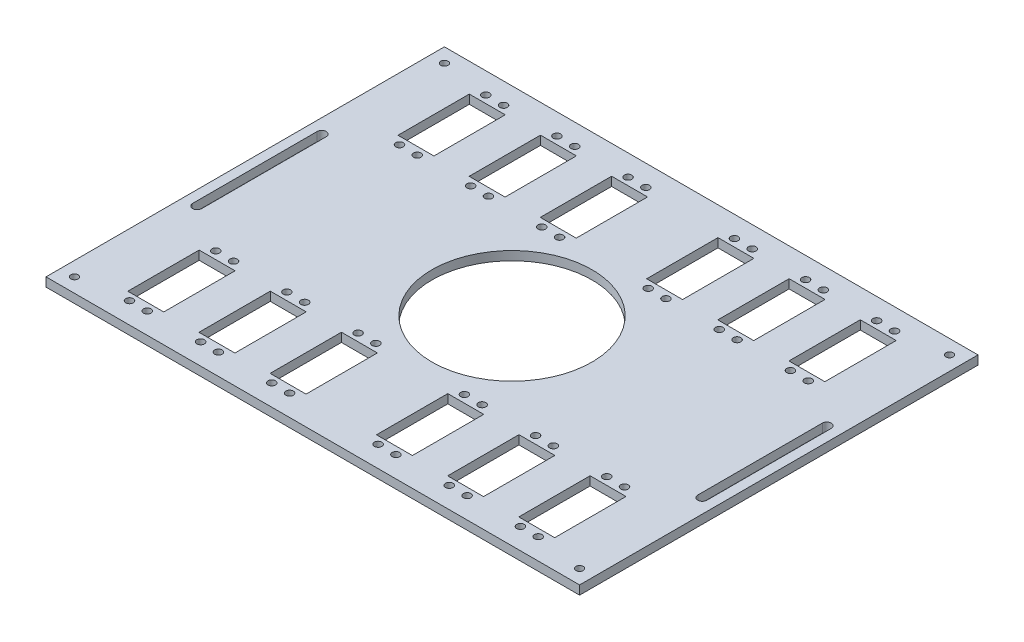
from build123d import *

# Parameters (mm, degrees)
SKETCH1_W                                  = 300
SKETCH1_H                                  = 224
BOSS_EXTRUDE2_DEPTH                        = 5
CUT_EXTRUDE1_REACH                         = 189.267
SKETCH1_5_W                                = 20.2
SKETCH1_5_H                                = 40.1
SKETCH1_5_R                                = 2.1
LPATTERN1_COUNT                            = 3
LPATTERN1_PITCH                            = 40
MIRROR1_COPY_1_REACH                       = 189.267
MIRROR1_COPY_1_SKETCH_W                    = 20.2
MIRROR1_COPY_1_SKETCH_H                    = 40.1
MIRROR1_COPY_1_SKETCH_R                    = 2.1
MIRROR1_COPY_2_REACH                       = 189.267
MIRROR1_COPY_2_SKETCH_W                    = 20.2
MIRROR1_COPY_2_SKETCH_H                    = 40.1
MIRROR1_COPY_2_SKETCH_R                    = 2.1
MIRROR1_AT_THE_SECOND_PLANE_COPY_1_REACH   = 189.267
MIRROR1_AT_THE_SECOND_PLANE_COPY_1_SKETC_W = 20.2
MIRROR1_AT_THE_SECOND_PLANE_COPY_1_SKETC_H = 40.1
MIRROR1_AT_THE_SECOND_PLANE_COPY_1_SKETC_R = 2.1
MIRROR1_AT_THE_SECOND_PLANE_COPY_2_REACH   = 189.267
MIRROR1_AT_THE_SECOND_PLANE_COPY_2_SKETC_W = 20.2
MIRROR1_AT_THE_SECOND_PLANE_COPY_2_SKETC_H = 40.1
MIRROR1_AT_THE_SECOND_PLANE_COPY_2_SKETC_R = 2.1
MIRROR1_AT_THE_SECOND_PLANE_COPY_3_REACH   = 189.267
MIRROR1_AT_THE_SECOND_PLANE_COPY_3_SKETC_W = 20.2
MIRROR1_AT_THE_SECOND_PLANE_COPY_3_SKETC_H = 40.1
MIRROR1_AT_THE_SECOND_PLANE_COPY_3_SKETC_R = 2.1
MIRROR1_AT_THE_SECOND_PLANE_COPY_4_REACH   = 189.267
MIRROR1_AT_THE_SECOND_PLANE_COPY_4_SKETC_W = 20.2
MIRROR1_AT_THE_SECOND_PLANE_COPY_4_SKETC_H = 40.1
MIRROR1_AT_THE_SECOND_PLANE_COPY_4_SKETC_R = 2.1
MIRROR1_AT_THE_SECOND_PLANE_COPY_5_REACH   = 189.267
MIRROR1_AT_THE_SECOND_PLANE_COPY_5_SKETC_W = 20.2
MIRROR1_AT_THE_SECOND_PLANE_COPY_5_SKETC_H = 40.1
MIRROR1_AT_THE_SECOND_PLANE_COPY_5_SKETC_R = 2.1
CUT_EXTRUDE3_REACH                         = 189.267
SKETCH1_6_R                                = 2.05
MIRROR2_AT_THE_SECOND_PLANE_COPY_1_REACH   = 189.267
MIRROR2_AT_THE_SECOND_PLANE_COPY_1_SKETC_R = 2.05
CUT_EXTRUDE4_REACH                         = 189.267
SKETCH2_R                                  = 45
CUT_EXTRUDE5_DEPTH                         = 10


with BuildPart() as part:
    # Sketch1 → Boss-Extrude2 (new body)
    with BuildSketch(Plane(origin=(0, 0, 0), x_dir=(1, 0, 0), z_dir=(0, 1, 0))):
        Rectangle(SKETCH1_W, SKETCH1_H)
    extrude(amount=BOSS_EXTRUDE2_DEPTH)

    # Sketch1<5> → Cut-Extrude1 (cut, up to next)
    with BuildSketch(Plane(origin=(0, 0, 0), x_dir=(1, 0, 0), z_dir=(0, 1, 0)), mode=Mode.PRIVATE) as cut_extrude1_sk1:
        with Locations((-109.9, 75.95)):
            Rectangle(SKETCH1_5_W, SKETCH1_5_H)
    cut_extrude1_tool1 = extrude(cut_extrude1_sk1.sketch, amount=CUT_EXTRUDE1_REACH, mode=Mode.PRIVATE) & part.part
    # Sketch1<5> → Cut-Extrude1 (cut, up to next)
    with BuildSketch(Plane(origin=(0, 0, 0), x_dir=(1, 0, 0), z_dir=(0, 1, 0)), mode=Mode.PRIVATE) as cut_extrude1_sk2:
        with Locations(Location((-104.9, 100.155703663, 0), (0, 0, 270))):
            Circle(SKETCH1_5_R)
    cut_extrude1_tool2 = extrude(cut_extrude1_sk2.sketch, amount=CUT_EXTRUDE1_REACH, mode=Mode.PRIVATE) & part.part
    # Sketch1<5> → Cut-Extrude1 (cut, up to next)
    with BuildSketch(Plane(origin=(0, 0, 0), x_dir=(1, 0, 0), z_dir=(0, 1, 0)), mode=Mode.PRIVATE) as cut_extrude1_sk3:
        with Locations(Location((-114.9, 100.155703663, 0), (0, 0, 270))):
            Circle(SKETCH1_5_R)
    cut_extrude1_tool3 = extrude(cut_extrude1_sk3.sketch, amount=CUT_EXTRUDE1_REACH, mode=Mode.PRIVATE) & part.part
    # Sketch1<5> → Cut-Extrude1 (cut, up to next)
    with BuildSketch(Plane(origin=(0, 0, 0), x_dir=(1, 0, 0), z_dir=(0, 1, 0)), mode=Mode.PRIVATE) as cut_extrude1_sk4:
        with Locations(Location((-114.9, 51.655703663, 0), (0, 0, 270))):
            Circle(SKETCH1_5_R)
    cut_extrude1_tool4 = extrude(cut_extrude1_sk4.sketch, amount=CUT_EXTRUDE1_REACH, mode=Mode.PRIVATE) & part.part
    # Sketch1<5> → Cut-Extrude1 (cut, up to next)
    with BuildSketch(Plane(origin=(0, 0, 0), x_dir=(1, 0, 0), z_dir=(0, 1, 0)), mode=Mode.PRIVATE) as cut_extrude1_sk5:
        with Locations(Location((-104.9, 51.655703663, 0), (0, 0, 270))):
            Circle(SKETCH1_5_R)
    cut_extrude1_tool5 = extrude(cut_extrude1_sk5.sketch, amount=CUT_EXTRUDE1_REACH, mode=Mode.PRIVATE) & part.part
    cut_extrude1_1 = cut_extrude1_tool1.solids().sort_by_distance((-109.9, 0, -75.95))[0]
    add(cut_extrude1_1, mode=Mode.SUBTRACT)
    cut_extrude1_2 = cut_extrude1_tool2.solids().sort_by_distance((-104.9, 0, -100.155704))[0]
    add(cut_extrude1_2, mode=Mode.SUBTRACT)
    cut_extrude1_3 = cut_extrude1_tool3.solids().sort_by_distance((-114.9, 0, -100.155704))[0]
    add(cut_extrude1_3, mode=Mode.SUBTRACT)
    cut_extrude1_4 = cut_extrude1_tool4.solids().sort_by_distance((-114.9, 0, -51.655704))[0]
    add(cut_extrude1_4, mode=Mode.SUBTRACT)
    cut_extrude1_5 = cut_extrude1_tool5.solids().sort_by_distance((-104.9, 0, -51.655704))[0]
    add(cut_extrude1_5, mode=Mode.SUBTRACT)
    cut_extrude1 = cut_extrude1_1 + cut_extrude1_2 + cut_extrude1_3 + cut_extrude1_4 + cut_extrude1_5  # Cut-Extrude1 as one shape, for the pattern or mirror that repeats it

    # LPattern1: Cut-Extrude1 ×3
    with Locations(*[(i * LPATTERN1_PITCH, 0, 0) for i in range(1, LPATTERN1_COUNT)]):
        add(cut_extrude1, mode=Mode.SUBTRACT)

    # Mirror1: Cut-Extrude1 across plane
    add(cut_extrude1.mirror(Plane.XY), mode=Mode.SUBTRACT)

    # Mirror1 copy 1 sketch → Mirror1 copy 1 (cut, up to next)
    with BuildSketch(Plane(origin=(40, 0, 0), x_dir=(1, 0, 0), z_dir=(0, 1, 0)), mode=Mode.PRIVATE) as mirror1_copy_1_sk1:
        with Locations((-109.9, -75.95)):
            Rectangle(MIRROR1_COPY_1_SKETCH_W, MIRROR1_COPY_1_SKETCH_H)
    mirror1_copy_1_tool1 = extrude(mirror1_copy_1_sk1.sketch, amount=MIRROR1_COPY_1_REACH, mode=Mode.PRIVATE) & part.part
    # Mirror1 copy 1 sketch → Mirror1 copy 1 (cut, up to next)
    with BuildSketch(Plane(origin=(40, 0, 0), x_dir=(1, 0, 0), z_dir=(0, 1, 0)), mode=Mode.PRIVATE) as mirror1_copy_1_sk2:
        with Locations((-104.9, -100.155703663)):
            Circle(MIRROR1_COPY_1_SKETCH_R)
    mirror1_copy_1_tool2 = extrude(mirror1_copy_1_sk2.sketch, amount=MIRROR1_COPY_1_REACH, mode=Mode.PRIVATE) & part.part
    # Mirror1 copy 1 sketch → Mirror1 copy 1 (cut, up to next)
    with BuildSketch(Plane(origin=(40, 0, 0), x_dir=(1, 0, 0), z_dir=(0, 1, 0)), mode=Mode.PRIVATE) as mirror1_copy_1_sk3:
        with Locations((-114.9, -100.155703663)):
            Circle(MIRROR1_COPY_1_SKETCH_R)
    mirror1_copy_1_tool3 = extrude(mirror1_copy_1_sk3.sketch, amount=MIRROR1_COPY_1_REACH, mode=Mode.PRIVATE) & part.part
    # Mirror1 copy 1 sketch → Mirror1 copy 1 (cut, up to next)
    with BuildSketch(Plane(origin=(40, 0, 0), x_dir=(1, 0, 0), z_dir=(0, 1, 0)), mode=Mode.PRIVATE) as mirror1_copy_1_sk4:
        with Locations((-114.9, -51.655703663)):
            Circle(MIRROR1_COPY_1_SKETCH_R)
    mirror1_copy_1_tool4 = extrude(mirror1_copy_1_sk4.sketch, amount=MIRROR1_COPY_1_REACH, mode=Mode.PRIVATE) & part.part
    # Mirror1 copy 1 sketch → Mirror1 copy 1 (cut, up to next)
    with BuildSketch(Plane(origin=(40, 0, 0), x_dir=(1, 0, 0), z_dir=(0, 1, 0)), mode=Mode.PRIVATE) as mirror1_copy_1_sk5:
        with Locations((-104.9, -51.655703663)):
            Circle(MIRROR1_COPY_1_SKETCH_R)
    mirror1_copy_1_tool5 = extrude(mirror1_copy_1_sk5.sketch, amount=MIRROR1_COPY_1_REACH, mode=Mode.PRIVATE) & part.part
    add(mirror1_copy_1_tool1.solids().sort_by_distance((-69.9, 0, 75.95))[0], mode=Mode.SUBTRACT)
    add(mirror1_copy_1_tool2.solids().sort_by_distance((-64.9, 0, 100.155704))[0], mode=Mode.SUBTRACT)
    add(mirror1_copy_1_tool3.solids().sort_by_distance((-74.9, 0, 100.155704))[0], mode=Mode.SUBTRACT)
    add(mirror1_copy_1_tool4.solids().sort_by_distance((-74.9, 0, 51.655704))[0], mode=Mode.SUBTRACT)
    add(mirror1_copy_1_tool5.solids().sort_by_distance((-64.9, 0, 51.655704))[0], mode=Mode.SUBTRACT)

    # Mirror1 copy 2 sketch → Mirror1 copy 2 (cut, up to next)
    with BuildSketch(Plane(origin=(80, 0, 0), x_dir=(1, 0, 0), z_dir=(0, 1, 0)), mode=Mode.PRIVATE) as mirror1_copy_2_sk1:
        with Locations((-109.9, -75.95)):
            Rectangle(MIRROR1_COPY_2_SKETCH_W, MIRROR1_COPY_2_SKETCH_H)
    mirror1_copy_2_tool1 = extrude(mirror1_copy_2_sk1.sketch, amount=MIRROR1_COPY_2_REACH, mode=Mode.PRIVATE) & part.part
    # Mirror1 copy 2 sketch → Mirror1 copy 2 (cut, up to next)
    with BuildSketch(Plane(origin=(80, 0, 0), x_dir=(1, 0, 0), z_dir=(0, 1, 0)), mode=Mode.PRIVATE) as mirror1_copy_2_sk2:
        with Locations((-104.9, -100.155703663)):
            Circle(MIRROR1_COPY_2_SKETCH_R)
    mirror1_copy_2_tool2 = extrude(mirror1_copy_2_sk2.sketch, amount=MIRROR1_COPY_2_REACH, mode=Mode.PRIVATE) & part.part
    # Mirror1 copy 2 sketch → Mirror1 copy 2 (cut, up to next)
    with BuildSketch(Plane(origin=(80, 0, 0), x_dir=(1, 0, 0), z_dir=(0, 1, 0)), mode=Mode.PRIVATE) as mirror1_copy_2_sk3:
        with Locations((-114.9, -100.155703663)):
            Circle(MIRROR1_COPY_2_SKETCH_R)
    mirror1_copy_2_tool3 = extrude(mirror1_copy_2_sk3.sketch, amount=MIRROR1_COPY_2_REACH, mode=Mode.PRIVATE) & part.part
    # Mirror1 copy 2 sketch → Mirror1 copy 2 (cut, up to next)
    with BuildSketch(Plane(origin=(80, 0, 0), x_dir=(1, 0, 0), z_dir=(0, 1, 0)), mode=Mode.PRIVATE) as mirror1_copy_2_sk4:
        with Locations((-114.9, -51.655703663)):
            Circle(MIRROR1_COPY_2_SKETCH_R)
    mirror1_copy_2_tool4 = extrude(mirror1_copy_2_sk4.sketch, amount=MIRROR1_COPY_2_REACH, mode=Mode.PRIVATE) & part.part
    # Mirror1 copy 2 sketch → Mirror1 copy 2 (cut, up to next)
    with BuildSketch(Plane(origin=(80, 0, 0), x_dir=(1, 0, 0), z_dir=(0, 1, 0)), mode=Mode.PRIVATE) as mirror1_copy_2_sk5:
        with Locations((-104.9, -51.655703663)):
            Circle(MIRROR1_COPY_2_SKETCH_R)
    mirror1_copy_2_tool5 = extrude(mirror1_copy_2_sk5.sketch, amount=MIRROR1_COPY_2_REACH, mode=Mode.PRIVATE) & part.part
    add(mirror1_copy_2_tool1.solids().sort_by_distance((-29.9, 0, 75.95))[0], mode=Mode.SUBTRACT)
    add(mirror1_copy_2_tool2.solids().sort_by_distance((-24.9, 0, 100.155704))[0], mode=Mode.SUBTRACT)
    add(mirror1_copy_2_tool3.solids().sort_by_distance((-34.9, 0, 100.155704))[0], mode=Mode.SUBTRACT)
    add(mirror1_copy_2_tool4.solids().sort_by_distance((-34.9, 0, 51.655704))[0], mode=Mode.SUBTRACT)
    add(mirror1_copy_2_tool5.solids().sort_by_distance((-24.9, 0, 51.655704))[0], mode=Mode.SUBTRACT)

    # Mirror1 at the second plane: Cut-Extrude1 across plane
    add(cut_extrude1.mirror(Plane(origin=(0, 0, 0), x_dir=(0, 0, 1), z_dir=(1, 0, 0))), mode=Mode.SUBTRACT)

    # Mirror1 at the second plane copy 1 sketc → Mirror1 at the second plane copy 1 (cut, up to next)
    with BuildSketch(Plane(origin=(-40, 0, 0), x_dir=(-1, 0, 0), z_dir=(0, 1, 0)), mode=Mode.PRIVATE) as mirror1_at_the_second_plane_copy_1_sk1:
        with Locations((-109.9, -75.95)):
            Rectangle(MIRROR1_AT_THE_SECOND_PLANE_COPY_1_SKETC_W, MIRROR1_AT_THE_SECOND_PLANE_COPY_1_SKETC_H)
    mirror1_at_the_second_plane_copy_1_tool1 = extrude(mirror1_at_the_second_plane_copy_1_sk1.sketch, amount=MIRROR1_AT_THE_SECOND_PLANE_COPY_1_REACH, mode=Mode.PRIVATE) & part.part
    # Mirror1 at the second plane copy 1 sketc → Mirror1 at the second plane copy 1 (cut, up to next)
    with BuildSketch(Plane(origin=(-40, 0, 0), x_dir=(-1, 0, 0), z_dir=(0, 1, 0)), mode=Mode.PRIVATE) as mirror1_at_the_second_plane_copy_1_sk2:
        with Locations((-104.9, -100.155703663)):
            Circle(MIRROR1_AT_THE_SECOND_PLANE_COPY_1_SKETC_R)
    mirror1_at_the_second_plane_copy_1_tool2 = extrude(mirror1_at_the_second_plane_copy_1_sk2.sketch, amount=MIRROR1_AT_THE_SECOND_PLANE_COPY_1_REACH, mode=Mode.PRIVATE) & part.part
    # Mirror1 at the second plane copy 1 sketc → Mirror1 at the second plane copy 1 (cut, up to next)
    with BuildSketch(Plane(origin=(-40, 0, 0), x_dir=(-1, 0, 0), z_dir=(0, 1, 0)), mode=Mode.PRIVATE) as mirror1_at_the_second_plane_copy_1_sk3:
        with Locations((-114.9, -100.155703663)):
            Circle(MIRROR1_AT_THE_SECOND_PLANE_COPY_1_SKETC_R)
    mirror1_at_the_second_plane_copy_1_tool3 = extrude(mirror1_at_the_second_plane_copy_1_sk3.sketch, amount=MIRROR1_AT_THE_SECOND_PLANE_COPY_1_REACH, mode=Mode.PRIVATE) & part.part
    # Mirror1 at the second plane copy 1 sketc → Mirror1 at the second plane copy 1 (cut, up to next)
    with BuildSketch(Plane(origin=(-40, 0, 0), x_dir=(-1, 0, 0), z_dir=(0, 1, 0)), mode=Mode.PRIVATE) as mirror1_at_the_second_plane_copy_1_sk4:
        with Locations((-114.9, -51.655703663)):
            Circle(MIRROR1_AT_THE_SECOND_PLANE_COPY_1_SKETC_R)
    mirror1_at_the_second_plane_copy_1_tool4 = extrude(mirror1_at_the_second_plane_copy_1_sk4.sketch, amount=MIRROR1_AT_THE_SECOND_PLANE_COPY_1_REACH, mode=Mode.PRIVATE) & part.part
    # Mirror1 at the second plane copy 1 sketc → Mirror1 at the second plane copy 1 (cut, up to next)
    with BuildSketch(Plane(origin=(-40, 0, 0), x_dir=(-1, 0, 0), z_dir=(0, 1, 0)), mode=Mode.PRIVATE) as mirror1_at_the_second_plane_copy_1_sk5:
        with Locations((-104.9, -51.655703663)):
            Circle(MIRROR1_AT_THE_SECOND_PLANE_COPY_1_SKETC_R)
    mirror1_at_the_second_plane_copy_1_tool5 = extrude(mirror1_at_the_second_plane_copy_1_sk5.sketch, amount=MIRROR1_AT_THE_SECOND_PLANE_COPY_1_REACH, mode=Mode.PRIVATE) & part.part
    add(mirror1_at_the_second_plane_copy_1_tool1.solids().sort_by_distance((69.9, 0, -75.95))[0], mode=Mode.SUBTRACT)
    add(mirror1_at_the_second_plane_copy_1_tool2.solids().sort_by_distance((64.9, 0, -100.155704))[0], mode=Mode.SUBTRACT)
    add(mirror1_at_the_second_plane_copy_1_tool3.solids().sort_by_distance((74.9, 0, -100.155704))[0], mode=Mode.SUBTRACT)
    add(mirror1_at_the_second_plane_copy_1_tool4.solids().sort_by_distance((74.9, 0, -51.655704))[0], mode=Mode.SUBTRACT)
    add(mirror1_at_the_second_plane_copy_1_tool5.solids().sort_by_distance((64.9, 0, -51.655704))[0], mode=Mode.SUBTRACT)

    # Mirror1 at the second plane copy 2 sketc → Mirror1 at the second plane copy 2 (cut, up to next)
    with BuildSketch(Plane(origin=(-80, 0, 0), x_dir=(-1, 0, 0), z_dir=(0, 1, 0)), mode=Mode.PRIVATE) as mirror1_at_the_second_plane_copy_2_sk1:
        with Locations((-109.9, -75.95)):
            Rectangle(MIRROR1_AT_THE_SECOND_PLANE_COPY_2_SKETC_W, MIRROR1_AT_THE_SECOND_PLANE_COPY_2_SKETC_H)
    mirror1_at_the_second_plane_copy_2_tool1 = extrude(mirror1_at_the_second_plane_copy_2_sk1.sketch, amount=MIRROR1_AT_THE_SECOND_PLANE_COPY_2_REACH, mode=Mode.PRIVATE) & part.part
    # Mirror1 at the second plane copy 2 sketc → Mirror1 at the second plane copy 2 (cut, up to next)
    with BuildSketch(Plane(origin=(-80, 0, 0), x_dir=(-1, 0, 0), z_dir=(0, 1, 0)), mode=Mode.PRIVATE) as mirror1_at_the_second_plane_copy_2_sk2:
        with Locations((-104.9, -100.155703663)):
            Circle(MIRROR1_AT_THE_SECOND_PLANE_COPY_2_SKETC_R)
    mirror1_at_the_second_plane_copy_2_tool2 = extrude(mirror1_at_the_second_plane_copy_2_sk2.sketch, amount=MIRROR1_AT_THE_SECOND_PLANE_COPY_2_REACH, mode=Mode.PRIVATE) & part.part
    # Mirror1 at the second plane copy 2 sketc → Mirror1 at the second plane copy 2 (cut, up to next)
    with BuildSketch(Plane(origin=(-80, 0, 0), x_dir=(-1, 0, 0), z_dir=(0, 1, 0)), mode=Mode.PRIVATE) as mirror1_at_the_second_plane_copy_2_sk3:
        with Locations((-114.9, -100.155703663)):
            Circle(MIRROR1_AT_THE_SECOND_PLANE_COPY_2_SKETC_R)
    mirror1_at_the_second_plane_copy_2_tool3 = extrude(mirror1_at_the_second_plane_copy_2_sk3.sketch, amount=MIRROR1_AT_THE_SECOND_PLANE_COPY_2_REACH, mode=Mode.PRIVATE) & part.part
    # Mirror1 at the second plane copy 2 sketc → Mirror1 at the second plane copy 2 (cut, up to next)
    with BuildSketch(Plane(origin=(-80, 0, 0), x_dir=(-1, 0, 0), z_dir=(0, 1, 0)), mode=Mode.PRIVATE) as mirror1_at_the_second_plane_copy_2_sk4:
        with Locations((-114.9, -51.655703663)):
            Circle(MIRROR1_AT_THE_SECOND_PLANE_COPY_2_SKETC_R)
    mirror1_at_the_second_plane_copy_2_tool4 = extrude(mirror1_at_the_second_plane_copy_2_sk4.sketch, amount=MIRROR1_AT_THE_SECOND_PLANE_COPY_2_REACH, mode=Mode.PRIVATE) & part.part
    # Mirror1 at the second plane copy 2 sketc → Mirror1 at the second plane copy 2 (cut, up to next)
    with BuildSketch(Plane(origin=(-80, 0, 0), x_dir=(-1, 0, 0), z_dir=(0, 1, 0)), mode=Mode.PRIVATE) as mirror1_at_the_second_plane_copy_2_sk5:
        with Locations((-104.9, -51.655703663)):
            Circle(MIRROR1_AT_THE_SECOND_PLANE_COPY_2_SKETC_R)
    mirror1_at_the_second_plane_copy_2_tool5 = extrude(mirror1_at_the_second_plane_copy_2_sk5.sketch, amount=MIRROR1_AT_THE_SECOND_PLANE_COPY_2_REACH, mode=Mode.PRIVATE) & part.part
    add(mirror1_at_the_second_plane_copy_2_tool1.solids().sort_by_distance((29.9, 0, -75.95))[0], mode=Mode.SUBTRACT)
    add(mirror1_at_the_second_plane_copy_2_tool2.solids().sort_by_distance((24.9, 0, -100.155704))[0], mode=Mode.SUBTRACT)
    add(mirror1_at_the_second_plane_copy_2_tool3.solids().sort_by_distance((34.9, 0, -100.155704))[0], mode=Mode.SUBTRACT)
    add(mirror1_at_the_second_plane_copy_2_tool4.solids().sort_by_distance((34.9, 0, -51.655704))[0], mode=Mode.SUBTRACT)
    add(mirror1_at_the_second_plane_copy_2_tool5.solids().sort_by_distance((24.9, 0, -51.655704))[0], mode=Mode.SUBTRACT)

    # Mirror1 at the second plane copy 3 sketc → Mirror1 at the second plane copy 3 (cut, up to next)
    with BuildSketch(Plane(origin=(0, 0, 0), x_dir=(-1, 0, 0), z_dir=(0, 1, 0)), mode=Mode.PRIVATE) as mirror1_at_the_second_plane_copy_3_sk1:
        with Locations((-109.9, 75.95)):
            Rectangle(MIRROR1_AT_THE_SECOND_PLANE_COPY_3_SKETC_W, MIRROR1_AT_THE_SECOND_PLANE_COPY_3_SKETC_H)
    mirror1_at_the_second_plane_copy_3_tool1 = extrude(mirror1_at_the_second_plane_copy_3_sk1.sketch, amount=MIRROR1_AT_THE_SECOND_PLANE_COPY_3_REACH, mode=Mode.PRIVATE) & part.part
    # Mirror1 at the second plane copy 3 sketc → Mirror1 at the second plane copy 3 (cut, up to next)
    with BuildSketch(Plane(origin=(0, 0, 0), x_dir=(-1, 0, 0), z_dir=(0, 1, 0)), mode=Mode.PRIVATE) as mirror1_at_the_second_plane_copy_3_sk2:
        with Locations(Location((-104.9, 100.155703663, 0), (0, 0, 270))):
            Circle(MIRROR1_AT_THE_SECOND_PLANE_COPY_3_SKETC_R)
    mirror1_at_the_second_plane_copy_3_tool2 = extrude(mirror1_at_the_second_plane_copy_3_sk2.sketch, amount=MIRROR1_AT_THE_SECOND_PLANE_COPY_3_REACH, mode=Mode.PRIVATE) & part.part
    # Mirror1 at the second plane copy 3 sketc → Mirror1 at the second plane copy 3 (cut, up to next)
    with BuildSketch(Plane(origin=(0, 0, 0), x_dir=(-1, 0, 0), z_dir=(0, 1, 0)), mode=Mode.PRIVATE) as mirror1_at_the_second_plane_copy_3_sk3:
        with Locations(Location((-114.9, 100.155703663, 0), (0, 0, 270))):
            Circle(MIRROR1_AT_THE_SECOND_PLANE_COPY_3_SKETC_R)
    mirror1_at_the_second_plane_copy_3_tool3 = extrude(mirror1_at_the_second_plane_copy_3_sk3.sketch, amount=MIRROR1_AT_THE_SECOND_PLANE_COPY_3_REACH, mode=Mode.PRIVATE) & part.part
    # Mirror1 at the second plane copy 3 sketc → Mirror1 at the second plane copy 3 (cut, up to next)
    with BuildSketch(Plane(origin=(0, 0, 0), x_dir=(-1, 0, 0), z_dir=(0, 1, 0)), mode=Mode.PRIVATE) as mirror1_at_the_second_plane_copy_3_sk4:
        with Locations(Location((-114.9, 51.655703663, 0), (0, 0, 270))):
            Circle(MIRROR1_AT_THE_SECOND_PLANE_COPY_3_SKETC_R)
    mirror1_at_the_second_plane_copy_3_tool4 = extrude(mirror1_at_the_second_plane_copy_3_sk4.sketch, amount=MIRROR1_AT_THE_SECOND_PLANE_COPY_3_REACH, mode=Mode.PRIVATE) & part.part
    # Mirror1 at the second plane copy 3 sketc → Mirror1 at the second plane copy 3 (cut, up to next)
    with BuildSketch(Plane(origin=(0, 0, 0), x_dir=(-1, 0, 0), z_dir=(0, 1, 0)), mode=Mode.PRIVATE) as mirror1_at_the_second_plane_copy_3_sk5:
        with Locations(Location((-104.9, 51.655703663, 0), (0, 0, 270))):
            Circle(MIRROR1_AT_THE_SECOND_PLANE_COPY_3_SKETC_R)
    mirror1_at_the_second_plane_copy_3_tool5 = extrude(mirror1_at_the_second_plane_copy_3_sk5.sketch, amount=MIRROR1_AT_THE_SECOND_PLANE_COPY_3_REACH, mode=Mode.PRIVATE) & part.part
    add(mirror1_at_the_second_plane_copy_3_tool1.solids().sort_by_distance((109.9, 0, 75.95))[0], mode=Mode.SUBTRACT)
    add(mirror1_at_the_second_plane_copy_3_tool2.solids().sort_by_distance((104.9, 0, 100.155704))[0], mode=Mode.SUBTRACT)
    add(mirror1_at_the_second_plane_copy_3_tool3.solids().sort_by_distance((114.9, 0, 100.155704))[0], mode=Mode.SUBTRACT)
    add(mirror1_at_the_second_plane_copy_3_tool4.solids().sort_by_distance((114.9, 0, 51.655704))[0], mode=Mode.SUBTRACT)
    add(mirror1_at_the_second_plane_copy_3_tool5.solids().sort_by_distance((104.9, 0, 51.655704))[0], mode=Mode.SUBTRACT)

    # Mirror1 at the second plane copy 4 sketc → Mirror1 at the second plane copy 4 (cut, up to next)
    with BuildSketch(Plane(origin=(-40, 0, 0), x_dir=(-1, 0, 0), z_dir=(0, 1, 0)), mode=Mode.PRIVATE) as mirror1_at_the_second_plane_copy_4_sk1:
        with Locations((-109.9, 75.95)):
            Rectangle(MIRROR1_AT_THE_SECOND_PLANE_COPY_4_SKETC_W, MIRROR1_AT_THE_SECOND_PLANE_COPY_4_SKETC_H)
    mirror1_at_the_second_plane_copy_4_tool1 = extrude(mirror1_at_the_second_plane_copy_4_sk1.sketch, amount=MIRROR1_AT_THE_SECOND_PLANE_COPY_4_REACH, mode=Mode.PRIVATE) & part.part
    # Mirror1 at the second plane copy 4 sketc → Mirror1 at the second plane copy 4 (cut, up to next)
    with BuildSketch(Plane(origin=(-40, 0, 0), x_dir=(-1, 0, 0), z_dir=(0, 1, 0)), mode=Mode.PRIVATE) as mirror1_at_the_second_plane_copy_4_sk2:
        with Locations(Location((-104.9, 100.155703663, 0), (0, 0, 270))):
            Circle(MIRROR1_AT_THE_SECOND_PLANE_COPY_4_SKETC_R)
    mirror1_at_the_second_plane_copy_4_tool2 = extrude(mirror1_at_the_second_plane_copy_4_sk2.sketch, amount=MIRROR1_AT_THE_SECOND_PLANE_COPY_4_REACH, mode=Mode.PRIVATE) & part.part
    # Mirror1 at the second plane copy 4 sketc → Mirror1 at the second plane copy 4 (cut, up to next)
    with BuildSketch(Plane(origin=(-40, 0, 0), x_dir=(-1, 0, 0), z_dir=(0, 1, 0)), mode=Mode.PRIVATE) as mirror1_at_the_second_plane_copy_4_sk3:
        with Locations(Location((-114.9, 100.155703663, 0), (0, 0, 270))):
            Circle(MIRROR1_AT_THE_SECOND_PLANE_COPY_4_SKETC_R)
    mirror1_at_the_second_plane_copy_4_tool3 = extrude(mirror1_at_the_second_plane_copy_4_sk3.sketch, amount=MIRROR1_AT_THE_SECOND_PLANE_COPY_4_REACH, mode=Mode.PRIVATE) & part.part
    # Mirror1 at the second plane copy 4 sketc → Mirror1 at the second plane copy 4 (cut, up to next)
    with BuildSketch(Plane(origin=(-40, 0, 0), x_dir=(-1, 0, 0), z_dir=(0, 1, 0)), mode=Mode.PRIVATE) as mirror1_at_the_second_plane_copy_4_sk4:
        with Locations(Location((-114.9, 51.655703663, 0), (0, 0, 270))):
            Circle(MIRROR1_AT_THE_SECOND_PLANE_COPY_4_SKETC_R)
    mirror1_at_the_second_plane_copy_4_tool4 = extrude(mirror1_at_the_second_plane_copy_4_sk4.sketch, amount=MIRROR1_AT_THE_SECOND_PLANE_COPY_4_REACH, mode=Mode.PRIVATE) & part.part
    # Mirror1 at the second plane copy 4 sketc → Mirror1 at the second plane copy 4 (cut, up to next)
    with BuildSketch(Plane(origin=(-40, 0, 0), x_dir=(-1, 0, 0), z_dir=(0, 1, 0)), mode=Mode.PRIVATE) as mirror1_at_the_second_plane_copy_4_sk5:
        with Locations(Location((-104.9, 51.655703663, 0), (0, 0, 270))):
            Circle(MIRROR1_AT_THE_SECOND_PLANE_COPY_4_SKETC_R)
    mirror1_at_the_second_plane_copy_4_tool5 = extrude(mirror1_at_the_second_plane_copy_4_sk5.sketch, amount=MIRROR1_AT_THE_SECOND_PLANE_COPY_4_REACH, mode=Mode.PRIVATE) & part.part
    add(mirror1_at_the_second_plane_copy_4_tool1.solids().sort_by_distance((69.9, 0, 75.95))[0], mode=Mode.SUBTRACT)
    add(mirror1_at_the_second_plane_copy_4_tool2.solids().sort_by_distance((64.9, 0, 100.155704))[0], mode=Mode.SUBTRACT)
    add(mirror1_at_the_second_plane_copy_4_tool3.solids().sort_by_distance((74.9, 0, 100.155704))[0], mode=Mode.SUBTRACT)
    add(mirror1_at_the_second_plane_copy_4_tool4.solids().sort_by_distance((74.9, 0, 51.655704))[0], mode=Mode.SUBTRACT)
    add(mirror1_at_the_second_plane_copy_4_tool5.solids().sort_by_distance((64.9, 0, 51.655704))[0], mode=Mode.SUBTRACT)

    # Mirror1 at the second plane copy 5 sketc → Mirror1 at the second plane copy 5 (cut, up to next)
    with BuildSketch(Plane(origin=(-80, 0, 0), x_dir=(-1, 0, 0), z_dir=(0, 1, 0)), mode=Mode.PRIVATE) as mirror1_at_the_second_plane_copy_5_sk1:
        with Locations((-109.9, 75.95)):
            Rectangle(MIRROR1_AT_THE_SECOND_PLANE_COPY_5_SKETC_W, MIRROR1_AT_THE_SECOND_PLANE_COPY_5_SKETC_H)
    mirror1_at_the_second_plane_copy_5_tool1 = extrude(mirror1_at_the_second_plane_copy_5_sk1.sketch, amount=MIRROR1_AT_THE_SECOND_PLANE_COPY_5_REACH, mode=Mode.PRIVATE) & part.part
    # Mirror1 at the second plane copy 5 sketc → Mirror1 at the second plane copy 5 (cut, up to next)
    with BuildSketch(Plane(origin=(-80, 0, 0), x_dir=(-1, 0, 0), z_dir=(0, 1, 0)), mode=Mode.PRIVATE) as mirror1_at_the_second_plane_copy_5_sk2:
        with Locations(Location((-104.9, 100.155703663, 0), (0, 0, 270))):
            Circle(MIRROR1_AT_THE_SECOND_PLANE_COPY_5_SKETC_R)
    mirror1_at_the_second_plane_copy_5_tool2 = extrude(mirror1_at_the_second_plane_copy_5_sk2.sketch, amount=MIRROR1_AT_THE_SECOND_PLANE_COPY_5_REACH, mode=Mode.PRIVATE) & part.part
    # Mirror1 at the second plane copy 5 sketc → Mirror1 at the second plane copy 5 (cut, up to next)
    with BuildSketch(Plane(origin=(-80, 0, 0), x_dir=(-1, 0, 0), z_dir=(0, 1, 0)), mode=Mode.PRIVATE) as mirror1_at_the_second_plane_copy_5_sk3:
        with Locations(Location((-114.9, 100.155703663, 0), (0, 0, 270))):
            Circle(MIRROR1_AT_THE_SECOND_PLANE_COPY_5_SKETC_R)
    mirror1_at_the_second_plane_copy_5_tool3 = extrude(mirror1_at_the_second_plane_copy_5_sk3.sketch, amount=MIRROR1_AT_THE_SECOND_PLANE_COPY_5_REACH, mode=Mode.PRIVATE) & part.part
    # Mirror1 at the second plane copy 5 sketc → Mirror1 at the second plane copy 5 (cut, up to next)
    with BuildSketch(Plane(origin=(-80, 0, 0), x_dir=(-1, 0, 0), z_dir=(0, 1, 0)), mode=Mode.PRIVATE) as mirror1_at_the_second_plane_copy_5_sk4:
        with Locations(Location((-114.9, 51.655703663, 0), (0, 0, 270))):
            Circle(MIRROR1_AT_THE_SECOND_PLANE_COPY_5_SKETC_R)
    mirror1_at_the_second_plane_copy_5_tool4 = extrude(mirror1_at_the_second_plane_copy_5_sk4.sketch, amount=MIRROR1_AT_THE_SECOND_PLANE_COPY_5_REACH, mode=Mode.PRIVATE) & part.part
    # Mirror1 at the second plane copy 5 sketc → Mirror1 at the second plane copy 5 (cut, up to next)
    with BuildSketch(Plane(origin=(-80, 0, 0), x_dir=(-1, 0, 0), z_dir=(0, 1, 0)), mode=Mode.PRIVATE) as mirror1_at_the_second_plane_copy_5_sk5:
        with Locations(Location((-104.9, 51.655703663, 0), (0, 0, 270))):
            Circle(MIRROR1_AT_THE_SECOND_PLANE_COPY_5_SKETC_R)
    mirror1_at_the_second_plane_copy_5_tool5 = extrude(mirror1_at_the_second_plane_copy_5_sk5.sketch, amount=MIRROR1_AT_THE_SECOND_PLANE_COPY_5_REACH, mode=Mode.PRIVATE) & part.part
    add(mirror1_at_the_second_plane_copy_5_tool1.solids().sort_by_distance((29.9, 0, 75.95))[0], mode=Mode.SUBTRACT)
    add(mirror1_at_the_second_plane_copy_5_tool2.solids().sort_by_distance((24.9, 0, 100.155704))[0], mode=Mode.SUBTRACT)
    add(mirror1_at_the_second_plane_copy_5_tool3.solids().sort_by_distance((34.9, 0, 100.155704))[0], mode=Mode.SUBTRACT)
    add(mirror1_at_the_second_plane_copy_5_tool4.solids().sort_by_distance((34.9, 0, 51.655704))[0], mode=Mode.SUBTRACT)
    add(mirror1_at_the_second_plane_copy_5_tool5.solids().sort_by_distance((24.9, 0, 51.655704))[0], mode=Mode.SUBTRACT)

    # Sketch1<6> → Cut-Extrude3 (cut, up to next)
    with BuildSketch(Plane(origin=(0, 0, 0), x_dir=(1, 0, 0), z_dir=(0, 1, 0)), mode=Mode.PRIVATE) as cut_extrude3_sk1:
        with Locations(Location((-142, 104, 0), (0, 0, 270))):
            Circle(SKETCH1_6_R)
    cut_extrude3_tool1 = extrude(cut_extrude3_sk1.sketch, amount=CUT_EXTRUDE3_REACH, mode=Mode.PRIVATE) & part.part
    cut_extrude3 = cut_extrude3_tool1.solids().sort_by_distance((-142, 0, -104))[0]
    add(cut_extrude3, mode=Mode.SUBTRACT)

    # Mirror2: Cut-Extrude3 across plane
    add(cut_extrude3.mirror(Plane(origin=(0, 0, 0), x_dir=(0, 0, 1), z_dir=(1, 0, 0))), mode=Mode.SUBTRACT)

    # Mirror2 at the second plane: Cut-Extrude3 across plane
    add(cut_extrude3.mirror(Plane.XY), mode=Mode.SUBTRACT)

    # Mirror2 at the second plane copy 1 sketc → Mirror2 at the second plane copy 1 (cut, up to next)
    with BuildSketch(Plane(origin=(0, 0, 0), x_dir=(-1, 0, 0), z_dir=(0, 1, 0)), mode=Mode.PRIVATE) as mirror2_at_the_second_plane_copy_1_sk1:
        with Locations(Location((-142, 104, 0), (0, 0, 270))):
            Circle(MIRROR2_AT_THE_SECOND_PLANE_COPY_1_SKETC_R)
    mirror2_at_the_second_plane_copy_1_tool1 = extrude(mirror2_at_the_second_plane_copy_1_sk1.sketch, amount=MIRROR2_AT_THE_SECOND_PLANE_COPY_1_REACH, mode=Mode.PRIVATE) & part.part
    add(mirror2_at_the_second_plane_copy_1_tool1.solids().sort_by_distance((142, 0, 104))[0], mode=Mode.SUBTRACT)

    # Sketch2 → Cut-Extrude4 (cut, up to next)
    with BuildSketch(Plane(origin=(0, 5, 0), x_dir=(1, 0, 0), z_dir=(0, 1, 0)), mode=Mode.PRIVATE) as cut_extrude4_sk1:
        with Locations(Location((0, 0, 0), (0, 0, 270))):
            Circle(SKETCH2_R)
    cut_extrude4_tool1 = extrude(cut_extrude4_sk1.sketch, amount=-CUT_EXTRUDE4_REACH, mode=Mode.PRIVATE) & part.part
    add(cut_extrude4_tool1.solids().sort_by_distance((0, 5, 0))[0], mode=Mode.SUBTRACT)

    # Sketch3 → Cut-Extrude5 (cut)
    with BuildSketch(Plane(origin=(0, 5, 0), x_dir=(1, 0, 0), z_dir=(0, 1, 0))):
        with BuildLine():
            Line((-144.55, -35), (-144.55, 35))
            ThreePointArc((-144.55, 35), (-142, 37.55), (-139.45, 35))
            Line((-139.45, 35), (-139.45, -35))
            ThreePointArc((-139.45, -35), (-142, -37.55), (-144.55, -35))
        make_face()
        with BuildLine():
            Line((144.55, -35), (144.55, 35))
            ThreePointArc((144.55, 35), (142, 37.55), (139.45, 35))
            Line((139.45, 35), (139.45, -35))
            ThreePointArc((139.45, -35), (142, -37.55), (144.55, -35))
        make_face()
    extrude(amount=-CUT_EXTRUDE5_DEPTH, mode=Mode.SUBTRACT)


solid = part.part
